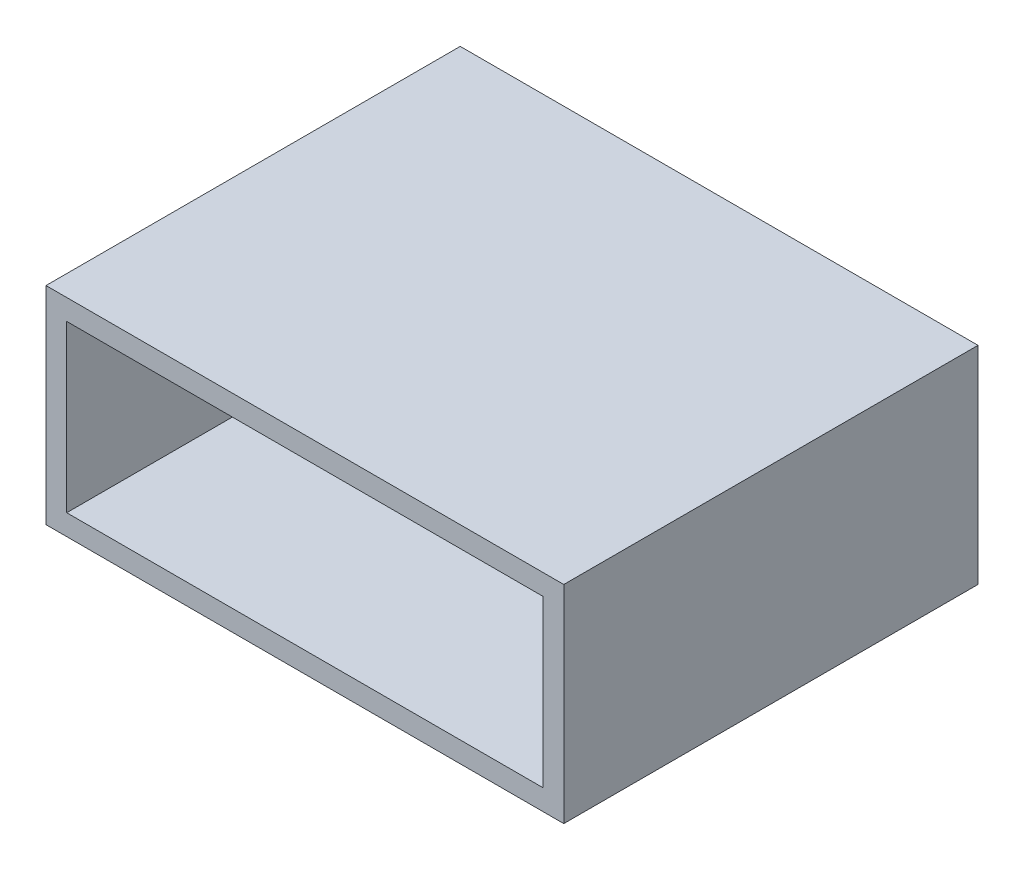
from build123d import *

# Parameters (mm, degrees)
SKETCH1_W           = 127
SKETCH1_H           = 50.8
BOSS_EXTRUDE1_DEPTH = 101.6
CUT_EXTRUDE1_REACH  = 172.388
SKETCH2_W           = 116.84
SKETCH2_H           = 40.64


with BuildPart() as part:
    # Sketch1 → Boss-Extrude1 (new body)
    with BuildSketch(Plane.XY):
        with Locations((63.5, -25.4)):
            Rectangle(SKETCH1_W, SKETCH1_H)
    extrude(amount=BOSS_EXTRUDE1_DEPTH)

    # Sketch2 → Cut-Extrude1 (cut, up to next)
    with BuildSketch(Plane(origin=(0, 0, 0), x_dir=(-1, 0, 0), z_dir=(0, 0, -1)), mode=Mode.PRIVATE) as cut_extrude1_sk1:
        with Locations((-63.5, -25.4)):
            Rectangle(SKETCH2_W, SKETCH2_H)
    cut_extrude1_tool1 = extrude(cut_extrude1_sk1.sketch, amount=-CUT_EXTRUDE1_REACH, mode=Mode.PRIVATE) & part.part
    add(cut_extrude1_tool1.solids().sort_by_distance((63.5, -25.4, 0))[0], mode=Mode.SUBTRACT)


solid = part.part
